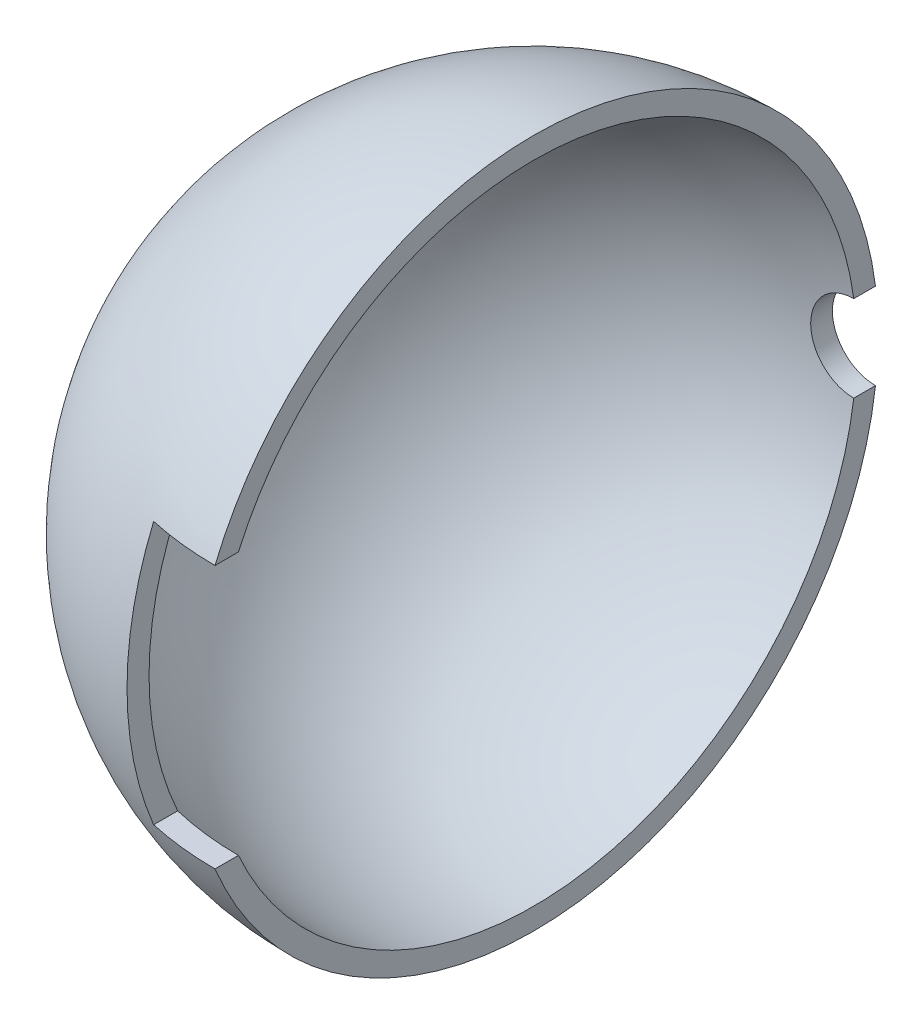
from build123d import *

# Parameters (mm, degrees)
SKETCH2_W               = 3.2
SKETCH2_H               = 6.1
CUT_EXTRUDE1_DEPTH      = 2
CUT_EXTRUDE2_REACH      = 21.464
CUT_EXTRUDE2_END_RADIUS = 7.5
SKETCH3_R               = 1


with BuildPart() as part:
    # Sketch1 → Revolve1 (revolve)
    with BuildSketch(Plane.XY):
        with BuildLine():
            Line((0, 8), (0, 7.5))
            ThreePointArc((0, 7.5), (-5.303300859, 5.303300859), (-7.5, 0))
            Line((-7.5, 0), (-8, 0))
            ThreePointArc((-8, 0), (-5.656854249, 5.656854249), (0, 8))
        make_face()
    revolve(axis=Axis((-8, 0, 0), (1, 0, 0)))

    # Sketch2 → Cut-Extrude1 (cut)
    with BuildSketch(Plane.XY.offset(8)):
        Rectangle(SKETCH2_W, SKETCH2_H)
    extrude(amount=-CUT_EXTRUDE1_DEPTH, mode=Mode.SUBTRACT)

    # Cut-Extrude2: up to this sphere (the profile starts outside it)
    cut_extrude2_end = Location((0, 0, 0)) * Sphere(CUT_EXTRUDE2_END_RADIUS, mode=Mode.PRIVATE)
    # Sketch3 → Cut-Extrude2 (cut, up to the surface)
    with BuildSketch(Plane.XY.offset(-8), mode=Mode.PRIVATE) as cut_extrude2_sk1:
        Circle(SKETCH3_R)
    cut_extrude2_tool1 = extrude(cut_extrude2_sk1.sketch, amount=CUT_EXTRUDE2_REACH, mode=Mode.PRIVATE) - cut_extrude2_end
    add(cut_extrude2_tool1.solids().sort_by_distance((0, 0, -8))[0], mode=Mode.SUBTRACT)


solid = part.part
